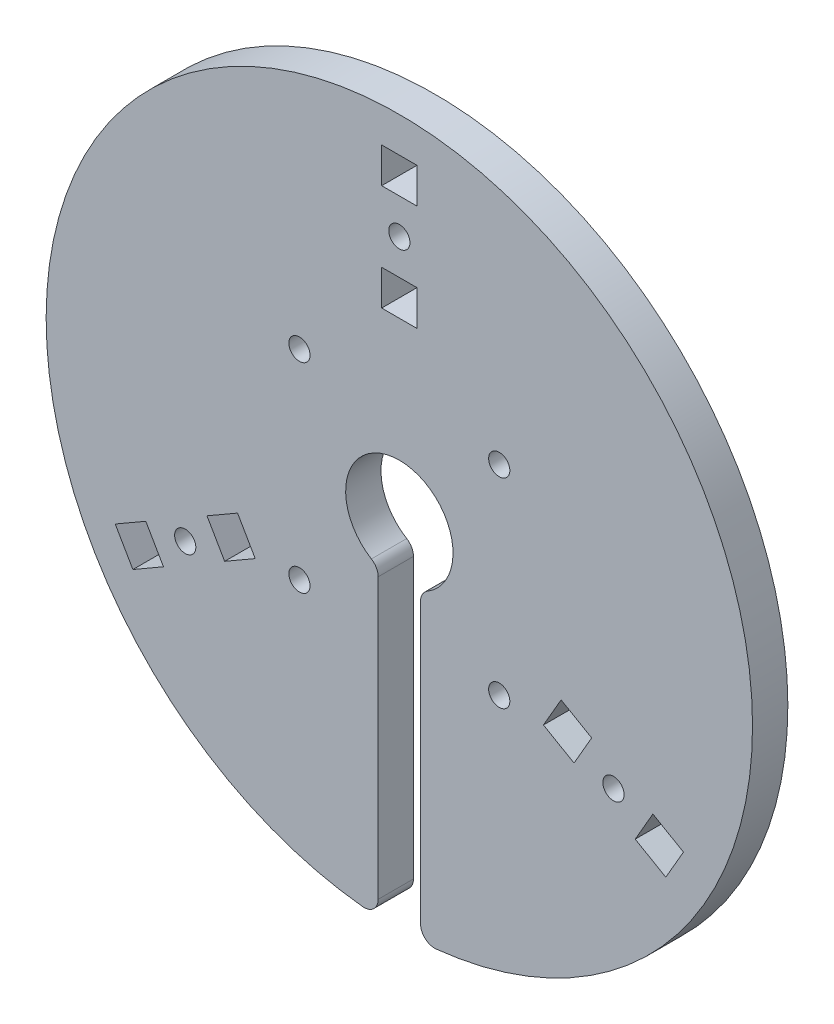
from build123d import *

# Parameters (mm, degrees)
ESQUISSE1_R        = 1.5
ESQUISSE1_W        = 5
ESQUISSE1_H        = 5
BOSS_EXTRU_1_DEPTH = 5
FILLET1_R          = 2


with BuildPart() as part:
    # Esquisse1 → Boss.-Extru.1 (new body)
    with BuildSketch(Plane.XY):
        with BuildLine():
            Line((-3, -6.9828361), (-3, -49.909918854))
            ThreePointArc((-3, -49.909918854), (0, 50), (3, -49.909918854))
            Line((3, -49.909918854), (3, -6.9828361))
            ThreePointArc((3, -6.9828361), (0, 7.6), (-3, -6.9828361))
        make_face()
        with Locations((14.142135624, 14.142135624)):
            Circle(ESQUISSE1_R, mode=Mode.SUBTRACT)
        with Locations(Location((14.142135624, -14.142135624, 0), (0, 0, 180))):
            Circle(ESQUISSE1_R, mode=Mode.SUBTRACT)
        with Locations(Location((-14.142135624, 14.142135624, 0), (0, 0, 180))):
            Circle(ESQUISSE1_R, mode=Mode.SUBTRACT)
        with Locations((-14.142135624, -14.142135624)):
            Circle(ESQUISSE1_R, mode=Mode.SUBTRACT)
        with Locations((0, 35)):
            Circle(ESQUISSE1_R, mode=Mode.SUBTRACT)
        with Locations((-30.310889132, -17.5)):
            Circle(ESQUISSE1_R, mode=Mode.SUBTRACT)
        with Locations((30.310889132, -17.5)):
            Circle(ESQUISSE1_R, mode=Mode.SUBTRACT)
        with Locations((0, 27.5)):
            Rectangle(ESQUISSE1_W, ESQUISSE1_H, mode=Mode.SUBTRACT)
        with Locations((0, 42.5)):
            Rectangle(ESQUISSE1_W, ESQUISSE1_H, mode=Mode.SUBTRACT)
        Polygon((-35.891016151, -17.834936491), (-40.22114317, -20.334936491), (-37.72114317, -24.665063509), (-33.391016151, -22.165063509), align=None, mode=Mode.SUBTRACT)
        Polygon((-27.230762114, -12.834936491), (-22.900635095, -10.334936491), (-20.400635095, -14.665063509), (-24.730762114, -17.165063509), align=None, mode=Mode.SUBTRACT)
        Polygon((27.230762114, -12.834936491), (22.900635095, -10.334936491), (20.400635095, -14.665063509), (24.730762114, -17.165063509), align=None, mode=Mode.SUBTRACT)
        Polygon((35.891016151, -17.834936491), (40.22114317, -20.334936491), (37.72114317, -24.665063509), (33.391016151, -22.165063509), align=None, mode=Mode.SUBTRACT)
    extrude(amount=BOSS_EXTRU_1_DEPTH)

    # Fillet1
    fillet1_edges = [part.edges().sort_by_distance(p)[0] for p in [
        (-3, -6.9828361, 2.5),
        (-3, -49.909918854, 2.5),
        (3, -49.909918854, 2.5),
        (3, -6.9828361, 2.5),
    ]]
    fillet(fillet1_edges, radius=FILLET1_R)


solid = part.part
